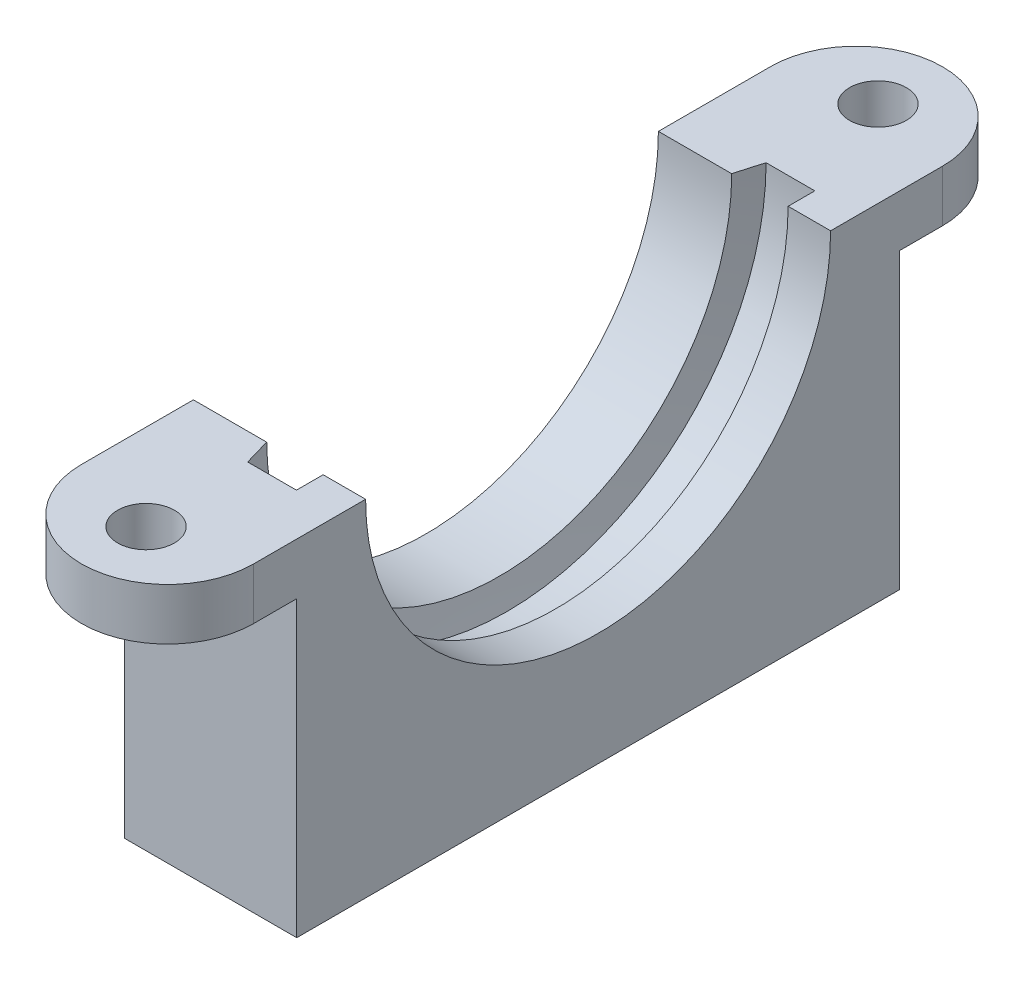
from build123d import *

# Parameters (mm, degrees)
SKETCH1_W           = 10
SKETCH1_H           = 20.05
BOSS_EXTRUDE4_DEPTH = 17.5
SKETCH11_R          = 13.5
CUT_EXTRUDE5_DEPTH  = 29.42978192
SKETCH13_R          = 1.65
BOSS_EXTRUDE7_DEPTH = 3


with BuildPart() as part:
    # Sketch1 → Boss-Extrude4 (new, symmetric)
    with BuildSketch(Plane.XY):
        with Locations((-2.533836661, -10.025)):
            Rectangle(SKETCH1_W, SKETCH1_H)
    extrude(amount=BOSS_EXTRUDE4_DEPTH, both=True)

    # Sketch1<5> → Cut-Revolve4 (revolve, cut)
    with BuildSketch(Plane.XY):
        with BuildLine():
            Line((0, 15.05), (-2.83, 15.05))
            ThreePointArc((-2.83, 15.05), (-4.505197002, 7.607721109), (-5.067673322, 0))
            Line((-5.067673322, 0), (0, 0))
            Line((0, 0), (0, 15.05))
        make_face()
    revolve(axis=Axis((0, 0, 0), (-1, 0, 0)), mode=Mode.SUBTRACT)

    # Sketch11 → Cut-Extrude5 (cut, through all)
    with BuildSketch(Plane.ZY.offset(7.533836661)):
        Circle(SKETCH11_R)
    extrude(amount=-CUT_EXTRUDE5_DEPTH, mode=Mode.SUBTRACT)

    # Sketch13 → Boss-Extrude7 (add)
    # profile 1 of 2: a face of its own
    with BuildSketch(Plane(origin=(0, 0, 0), x_dir=(1, 0, 0), z_dir=(0, 1, 0))):
        with BuildLine():
            Line((2.466163339, 17.5), (-7.533836661, 17.5))
            Line((-7.533836661, 17.5), (-7.533836661, 20))
            ThreePointArc((-7.533836661, 20), (-2.533836661, 25), (2.466163339, 20))
            Line((2.466163339, 20), (2.466163339, 17.5))
        make_face()
        with Locations((-2.533836661, 21.25)):
            Circle(SKETCH13_R, mode=Mode.SUBTRACT)
    # profile 2 of 2: a face of its own
    with BuildSketch(Plane(origin=(0, 0, 0), x_dir=(1, 0, 0), z_dir=(0, 1, 0))):
        with BuildLine():
            Line((2.466163339, -17.5), (-7.533836661, -17.5))
            Line((-7.533836661, -17.5), (-7.533836661, -20))
            ThreePointArc((-7.533836661, -20), (-2.533836661, -25), (2.466163339, -20))
            Line((2.466163339, -20), (2.466163339, -17.5))
        make_face()
        with Locations((-2.533836661, -21.25)):
            Circle(SKETCH13_R, mode=Mode.SUBTRACT)
    extrude(amount=-BOSS_EXTRUDE7_DEPTH)


solid = part.part
